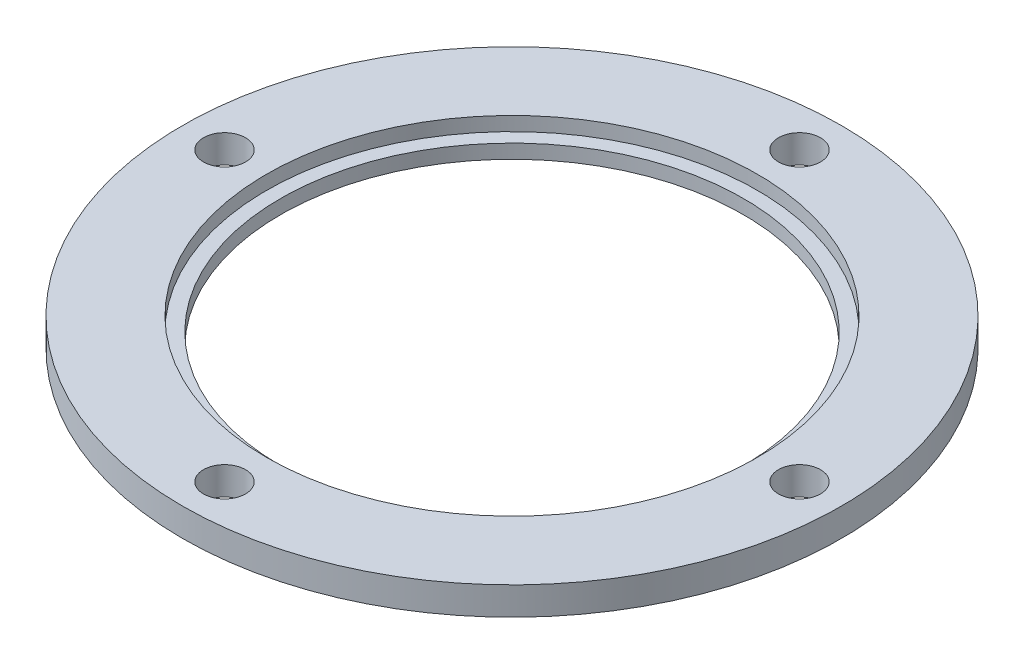
from build123d import *

# Parameters (mm, degrees)
SKETCH_1_R          = 23.5
SKETCH_1_R_2        = 17.5
SKETCH_1_R_3        = 16.5
EXTRUDE_1_DEPTH     = 1
SKETCH_2_R          = 23.5
SKETCH_2_R_2        = 17.5
EXTRUDE_2_DEPTH     = 1
SKETCH_3_R          = 1.5
CUT_EXTRUDE_1_DEPTH = 11


with BuildPart() as part:
    # 草图1 → 凸台-拉伸1 (new body)
    # profile 1 of 2: a face of its own
    with BuildSketch(Plane(origin=(0, 0, 0), x_dir=(1, 0, 0), z_dir=(0, 1, 0))):
        with Locations(Location((0, 0, 0), (0, 0, 270))):
            Circle(SKETCH_1_R)
        Circle(SKETCH_1_R_2, mode=Mode.SUBTRACT)
    # profile 2 of 2: a face of its own
    with BuildSketch(Plane(origin=(0, 0, 0), x_dir=(1, 0, 0), z_dir=(0, 1, 0))):
        Circle(SKETCH_1_R_2)
        with Locations(Location((0, 0, 0), (0, 0, 270))):
            Circle(SKETCH_1_R_3, mode=Mode.SUBTRACT)
    extrude(amount=EXTRUDE_1_DEPTH)

    # 草图2 → 凸台-拉伸2 (add)
    with BuildSketch(Plane(origin=(0, 1, 0), x_dir=(1, 0, 0), z_dir=(0, 1, 0))):
        with Locations(Location((0, 0, 0), (0, 0, 270))):
            Circle(SKETCH_2_R)
        with Locations(Location((0, 0, 0), (0, 0, 270))):
            Circle(SKETCH_2_R_2, mode=Mode.SUBTRACT)
    extrude(amount=EXTRUDE_2_DEPTH)

    # 草图3 → 切除-拉伸1 (cut)
    with BuildSketch(Plane(origin=(0, 2, 0), x_dir=(1, 0, 0), z_dir=(0, 1, 0))):
        with Locations(Location((0, 20.5, 0), (0, 0, 270))):
            Circle(SKETCH_3_R)
        with Locations(Location((20.5, 0, 0), (0, 0, 270))):
            Circle(SKETCH_3_R)
        with Locations(Location((0, -20.5, 0), (0, 0, 270))):
            Circle(SKETCH_3_R)
        with Locations(Location((-20.5, 0, 0), (0, 0, 270))):
            Circle(SKETCH_3_R)
    extrude(amount=-CUT_EXTRUDE_1_DEPTH, mode=Mode.SUBTRACT)


solid = part.part
